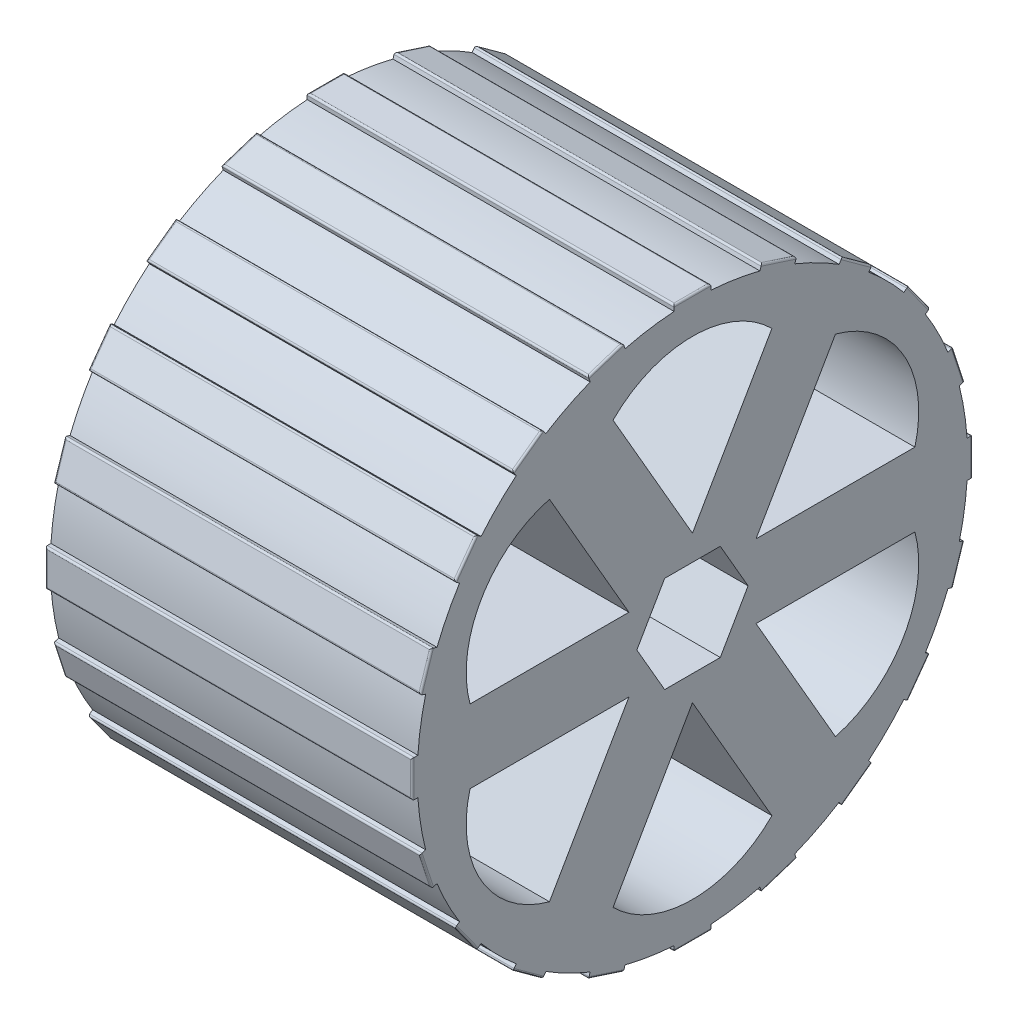
from build123d import *

# Parameters (mm, degrees)
BOSS_EXTRUDE1_DEPTH = 50.8
FILLET1_R           = 0.254
CUT_EXTRUDE1_DEPTH  = 50.8
CUT_EXTRUDE2_DEPTH  = 50.8


with BuildPart() as part:
    # Sketch1 → Boss-Extrude1 (new body)
    with BuildSketch(Plane(origin=(0, 0, 0), x_dir=(0, 0, -1), z_dir=(1, 0, 0))):
        with BuildLine():
            Line((-2.5399999999999996, 38.01523904962325), (-2.5400000000000005, 38.77723904962325))
            Line((-2.5400000000000005, 38.77723904962325), (2.5399999999999996, 38.77723904962325))
            Line((2.5399999999999996, 38.77723904962325), (2.5399999999999996, 38.01523904962325))
            ThreePointArc((2.5399999999999996, 38.01523904962325), (5.960153118032799, 37.63092577667475), (9.331671360170018, 36.93954398237454))
            Line((9.331671360170018, 36.93954398237454), (9.567142309883728, 37.664249047791444))
            Line((9.567142309883728, 37.664249047791444), (14.39850941266311, 36.094442716366714))
            Line((14.39850941266311, 36.094442716366714), (14.1630384629494, 35.369737650949816))
            ThreePointArc((14.1630384629494, 35.369737650949816), (17.297038040076735, 33.94734857157682), (20.289893710029112, 32.24794897719422))
            Line((20.289893710029112, 32.24794897719422), (20.737786072275973, 32.86441992690792))
            Line((20.737786072275973, 32.86441992690792), (24.84759240370071, 29.878470845262164))
            Line((24.84759240370071, 29.878470845262164), (24.399700041453848, 29.261999895548456))
            ThreePointArc((24.399700041453848, 29.261999895548456), (26.940768363207468, 26.940768363207464), (29.261999895548456, 24.399700041453848))
            Line((29.261999895548456, 24.399700041453848), (29.878470845262164, 24.84759240370071))
            Line((29.878470845262164, 24.84759240370071), (32.86441992690792, 20.737786072275973))
            Line((32.86441992690792, 20.737786072275973), (32.24794897719422, 20.289893710029112))
            ThreePointArc((32.24794897719422, 20.289893710029112), (33.94734857157683, 17.29703804007674), (35.369737650949816, 14.163038462949403))
            Line((35.369737650949816, 14.163038462949403), (36.094442716366714, 14.398509412663111))
            Line((36.094442716366714, 14.398509412663111), (37.664249047791444, 9.56714230988373))
            Line((37.664249047791444, 9.56714230988373), (36.93954398237454, 9.331671360170022))
            ThreePointArc((36.93954398237454, 9.331671360170022), (37.630925776674744, 5.9601531180328), (38.01523904962325, 2.5400000000000027))
            Line((38.01523904962325, 2.5400000000000027), (38.77723904962325, 2.5400000000000027))
            Line((38.77723904962325, 2.5400000000000027), (38.77723904962325, -2.5399999999999974))
            Line((38.77723904962325, -2.5399999999999974), (38.01523904962325, -2.5399999999999974))
            ThreePointArc((38.01523904962325, -2.5399999999999974), (37.63092577667475, -5.960153118032793), (36.93954398237454, -9.331671360170015))
            Line((36.93954398237454, -9.331671360170015), (37.664249047791444, -9.567142309883724))
            Line((37.664249047791444, -9.567142309883724), (36.094442716366714, -14.398509412663106))
            Line((36.094442716366714, -14.398509412663106), (35.369737650949816, -14.163038462949396))
            ThreePointArc((35.369737650949816, -14.163038462949396), (33.947348571576825, -17.297038040076735), (32.24794897719422, -20.289893710029112))
            Line((32.24794897719422, -20.289893710029112), (32.86441992690793, -20.737786072275973))
            Line((32.86441992690793, -20.737786072275973), (29.87847084526217, -24.84759240370071))
            Line((29.87847084526217, -24.84759240370071), (29.26199989554846, -24.399700041453848))
            ThreePointArc((29.26199989554846, -24.399700041453848), (26.940768363207468, -26.940768363207464), (24.39970004145385, -29.261999895548453))
            Line((24.39970004145385, -29.261999895548453), (24.847592403700713, -29.878470845262157))
            Line((24.847592403700713, -29.878470845262157), (20.737786072275977, -32.864419926907914))
            Line((20.737786072275977, -32.864419926907914), (20.289893710029116, -32.24794897719421))
            ThreePointArc((20.289893710029116, -32.24794897719421), (17.297038040076735, -33.94734857157682), (14.163038462949402, -35.36973765094981))
            Line((14.163038462949402, -35.36973765094981), (14.398509412663111, -36.094442716366714))
            Line((14.398509412663111, -36.094442716366714), (9.567142309883732, -37.664249047791444))
            Line((9.567142309883732, -37.664249047791444), (9.331671360170024, -36.93954398237453))
            ThreePointArc((9.331671360170024, -36.93954398237453), (5.960153118032799, -37.63092577667475), (2.5400000000000054, -38.01523904962325))
            Line((2.5400000000000054, -38.01523904962325), (2.5400000000000054, -38.77723904962325))
            Line((2.5400000000000054, -38.77723904962325), (-2.539999999999995, -38.77723904962325))
            Line((-2.539999999999995, -38.77723904962325), (-2.539999999999995, -38.01523904962325))
            ThreePointArc((-2.539999999999995, -38.01523904962325), (-5.960153118032794, -37.63092577667475), (-9.331671360170015, -36.93954398237454))
            Line((-9.331671360170015, -36.93954398237454), (-9.567142309883721, -37.664249047791444))
            Line((-9.567142309883721, -37.664249047791444), (-14.398509412663103, -36.094442716366714))
            Line((-14.398509412663103, -36.094442716366714), (-14.163038462949393, -35.369737650949816))
            ThreePointArc((-14.163038462949393, -35.369737650949816), (-17.297038040076732, -33.947348571576825), (-20.289893710029112, -32.24794897719422))
            Line((-20.289893710029112, -32.24794897719422), (-20.737786072275973, -32.86441992690793))
            Line((-20.737786072275973, -32.86441992690793), (-24.84759240370071, -29.87847084526217))
            Line((-24.84759240370071, -29.87847084526217), (-24.399700041453848, -29.26199989554846))
            ThreePointArc((-24.399700041453848, -29.26199989554846), (-26.940768363207464, -26.940768363207468), (-29.261999895548453, -24.39970004145385))
            Line((-29.261999895548453, -24.39970004145385), (-29.878470845262157, -24.847592403700713))
            Line((-29.878470845262157, -24.847592403700713), (-32.864419926907914, -20.737786072275977))
            Line((-32.864419926907914, -20.737786072275977), (-32.24794897719421, -20.289893710029116))
            ThreePointArc((-32.24794897719421, -20.289893710029116), (-33.94734857157682, -17.29703804007674), (-35.36973765094981, -14.163038462949403))
            Line((-35.36973765094981, -14.163038462949403), (-36.094442716366714, -14.398509412663115))
            Line((-36.094442716366714, -14.398509412663115), (-37.664249047791444, -9.567142309883735))
            Line((-37.664249047791444, -9.567142309883735), (-36.93954398237453, -9.331671360170025))
            ThreePointArc((-36.93954398237453, -9.331671360170025), (-37.630925776674744, -5.9601531180328005), (-38.01523904962325, -2.5400000000000076))
            Line((-38.01523904962325, -2.5400000000000076), (-38.77723904962325, -2.5400000000000076))
            Line((-38.77723904962325, -2.5400000000000076), (-38.77723904962325, 2.539999999999993))
            Line((-38.77723904962325, 2.539999999999993), (-38.01523904962325, 2.539999999999993))
            ThreePointArc((-38.01523904962325, 2.539999999999993), (-37.630925776674744, 5.9601531180328005), (-36.93954398237454, 9.331671360170011))
            Line((-36.93954398237454, 9.331671360170011), (-37.664249047791444, 9.567142309883721))
            Line((-37.664249047791444, 9.567142309883721), (-36.094442716366714, 14.398509412663103))
            Line((-36.094442716366714, 14.398509412663103), (-35.369737650949816, 14.163038462949393))
            ThreePointArc((-35.369737650949816, 14.163038462949393), (-33.94734857157681, 17.297038040076735), (-32.24794897719422, 20.2898937100291))
            Line((-32.24794897719422, 20.2898937100291), (-32.86441992690793, 20.737786072275963))
            Line((-32.86441992690793, 20.737786072275963), (-29.87847084526217, 24.8475924037007))
            Line((-29.87847084526217, 24.8475924037007), (-29.26199989554846, 24.399700041453837))
            ThreePointArc((-29.26199989554846, 24.399700041453837), (-26.940768363207464, 26.940768363207468), (-24.39970004145385, 29.261999895548453))
            Line((-24.39970004145385, 29.261999895548453), (-24.847592403700716, 29.878470845262154))
            Line((-24.847592403700716, 29.878470845262154), (-20.737786072275984, 32.864419926907914))
            Line((-20.737786072275984, 32.864419926907914), (-20.289893710029123, 32.24794897719421))
            ThreePointArc((-20.289893710029123, 32.24794897719421), (-17.297038040076732, 33.947348571576825), (-14.163038462949407, 35.36973765094981))
            Line((-14.163038462949407, 35.36973765094981), (-14.398509412663119, 36.094442716366714))
            Line((-14.398509412663119, 36.094442716366714), (-9.567142309883739, 37.664249047791444))
            Line((-9.567142309883739, 37.664249047791444), (-9.331671360170029, 36.93954398237453))
            ThreePointArc((-9.331671360170029, 36.93954398237453), (-5.960153118032802, 37.630925776674744), (-2.5399999999999996, 38.01523904962325))
        make_face()
    extrude(amount=BOSS_EXTRUDE1_DEPTH)

    # Fillet1
    fillet1_edges = [part.edges().sort_by_distance(p)[0] for p in [
        (0, 31.371445386085036, 22.79268923798835),
        (0, 36.87934588207908, 11.98282586127343),
        (0, 38.77723904962325, 4.4e-16),
        (50.8, -11.982825861273426, 36.87934588207908),
        (50.8, -22.792689237988345, 31.371445386085036),
        (25.4, 37.664249047791444, -9.567142309883728),
        (25.4, 36.094442716366714, -14.39850941266311),
        (50.8, 38.77723904962325, 4.4e-16),
        (25.4, 32.86441992690792, -20.737786072275973),
        (25.4, 29.878470845262164, -24.84759240370071),
        (25.4, 24.84759240370071, -29.878470845262164),
        (25.4, 20.737786072275973, -32.86441992690792),
        (25.4, 14.398509412663111, -36.094442716366714),
        (25.4, 9.56714230988373, -37.664249047791444),
        (25.4, 2.5400000000000027, -38.77723904962325),
        (25.4, -2.5399999999999974, -38.77723904962325),
        (25.4, -9.567142309883724, -37.664249047791444),
        (25.4, -14.398509412663106, -36.094442716366714),
        (25.4, -20.737786072275973, -32.86441992690793),
        (25.4, -24.84759240370071, -29.87847084526217),
        (25.4, -29.878470845262157, -24.847592403700713),
        (25.4, -32.864419926907914, -20.737786072275977),
        (25.4, -36.094442716366714, -14.398509412663111),
        (25.4, -37.664249047791444, -9.567142309883732),
        (25.4, -38.77723904962325, -2.5400000000000054),
        (25.4, -38.77723904962325, 2.539999999999995),
        (25.4, -37.664249047791444, 9.567142309883721),
        (25.4, -36.094442716366714, 14.398509412663103),
        (25.4, -32.86441992690793, 20.737786072275973),
        (25.4, -29.87847084526217, 24.84759240370071),
        (25.4, -24.847592403700713, 29.878470845262157),
        (25.4, -20.737786072275977, 32.864419926907914),
        (25.4, -14.398509412663115, 36.094442716366714),
        (25.4, -9.567142309883735, 37.664249047791444),
        (25.4, -2.5400000000000076, 38.77723904962325),
        (25.4, 2.539999999999993, 38.77723904962325),
        (25.4, 9.567142309883721, 37.664249047791444),
        (25.4, 14.398509412663103, 36.094442716366714),
        (25.4, 20.737786072275963, 32.86441992690793),
        (25.4, 24.8475924037007, 29.87847084526217),
        (25.4, 29.878470845262154, 24.847592403700716),
        (25.4, 32.864419926907914, 20.737786072275984),
        (25.4, 36.094442716366714, 14.398509412663119),
        (25.4, 37.664249047791444, 9.567142309883739),
        (25.4, 38.77723904962325, 2.5400000000000005),
        (25.4, 38.77723904962325, -2.5399999999999996),
        (50.8, -31.37144538608505, 22.79268923798834),
        (50.8, -36.87934588207908, 11.982825861273412),
        (50.8, -38.77723904962325, -5.33e-15),
        (50.8, -36.87934588207908, -11.982825861273422),
        (50.8, -31.371445386085036, -22.792689237988345),
        (50.8, -22.79268923798834, -31.37144538608505),
        (50.8, -11.982825861273415, -36.87934588207908),
        (50.8, 2.66e-15, -38.77723904962325),
        (50.8, 11.98282586127342, -36.87934588207908),
        (50.8, 22.79268923798834, -31.371445386085043),
        (50.8, 36.87934588207908, 11.98282586127343),
        (50.8, 31.371445386085043, -22.79268923798834),
        (50.8, 36.87934588207908, -11.982825861273419),
        (50.8, 31.371445386085036, 22.79268923798835),
        (50.8, 22.79268923798833, 31.37144538608505),
        (0, 36.87934588207908, -11.982825861273419),
        (0, 31.371445386085043, -22.79268923798834),
        (50.8, 11.982825861273412, 36.87934588207908),
        (0, 22.79268923798834, -31.371445386085043),
        (0, 11.98282586127342, -36.87934588207908),
        (0, 2.66e-15, -38.77723904962325),
        (0, -11.982825861273415, -36.87934588207908),
        (0, -22.79268923798834, -31.37144538608505),
        (0, -31.371445386085036, -22.792689237988345),
        (0, -36.87934588207908, -11.982825861273422),
        (0, -38.77723904962325, -5.33e-15),
        (0, -36.87934588207908, 11.982825861273412),
        (0, -31.37144538608505, 22.79268923798834),
        (50.8, -7.55e-15, 38.77723904962325),
        (0, -22.792689237988345, 31.371445386085036),
        (0, -11.982825861273426, 36.87934588207908),
        (0, -7.55e-15, 38.77723904962325),
        (0, 11.982825861273412, 36.87934588207908),
        (0, 22.79268923798833, 31.37144538608505),
    ]]
    fillet(fillet1_edges, radius=FILLET1_R)

    # Sketch2 → Cut-Extrude1 (cut)
    with BuildSketch(Plane.ZY):
        Polygon((7.698965839643664, 0), (3.8494829198218277, 6.667500000000013), (-3.849482919821838, 6.667500000000012), (-7.6989658396436695, -1.73e-15), (-3.8494829198218348, -6.6675000000000075), (3.849482919821831, -6.6675000000000075), align=None)
    extrude(amount=-CUT_EXTRUDE1_DEPTH, mode=Mode.SUBTRACT)

    # Sketch3 → Cut-Extrude2 (cut)
    with BuildSketch(Plane.ZY):
        with BuildLine():
            Line((19.79734073051288, 24.130000000001075), (8.798818102450515, 5.080000000001073))
            Line((8.798818102450515, 5.080000000001073), (30.795863358575264, 5.08000000000107))
            ThreePointArc((30.795863358575264, 5.08000000000107), (29.241986226147795, 16.88286861930648), (19.79734073051288, 24.130000000001075))
        make_face()
        with BuildLine():
            Line((-3.47e-15, 10.160000000000005), (10.998522628062373, 29.210000000000004))
            ThreePointArc((10.998522628062373, 29.210000000000004), (1.84e-15, 33.765737238610804), (-10.998522628062371, 29.209999999999997))
            Line((-10.998522628062371, 29.209999999999997), (-3.47e-15, 10.160000000000005))
        make_face()
        with BuildLine():
            Line((30.795863358576497, -5.079999999998918), (8.798818102451754, -5.0799999999989245))
            Line((8.798818102451754, -5.0799999999989245), (19.797340730514133, -24.129999999998926))
            ThreePointArc((19.797340730514133, -24.129999999998926), (29.241986226149038, -16.882868619304325), (30.795863358576497, -5.079999999998918))
        make_face()
        with BuildLine():
            Line((10.998522628064851, -29.209999999999997), (2.47992e-12, -10.159999999999998))
            Line((2.47992e-12, -10.159999999999998), (-10.998522628059895, -29.21))
            ThreePointArc((-10.998522628059895, -29.21), (2.47924e-12, -33.765737238610804), (10.998522628064851, -29.209999999999997))
        make_face()
        with BuildLine():
            Line((-19.7973407305104, -24.130000000001083), (-8.798818102448037, -5.0800000000010765))
            Line((-8.798818102448037, -5.0800000000010765), (-30.79586335857278, -5.080000000001081))
            ThreePointArc((-30.79586335857278, -5.080000000001081), (-29.24198622614532, -16.882868619306485), (-19.7973407305104, -24.130000000001083))
        make_face()
        with BuildLine():
            Line((-30.795863358574017, 5.079999999998903), (-8.79881810244928, 5.079999999998919))
            Line((-8.79881810244928, 5.079999999998919), (-19.79734073051166, 24.129999999998915))
            ThreePointArc((-19.79734073051166, 24.129999999998915), (-29.241986226146565, 16.88286861930431), (-30.795863358574017, 5.079999999998903))
        make_face()
    extrude(amount=-CUT_EXTRUDE2_DEPTH, mode=Mode.SUBTRACT)


solid = part.part
